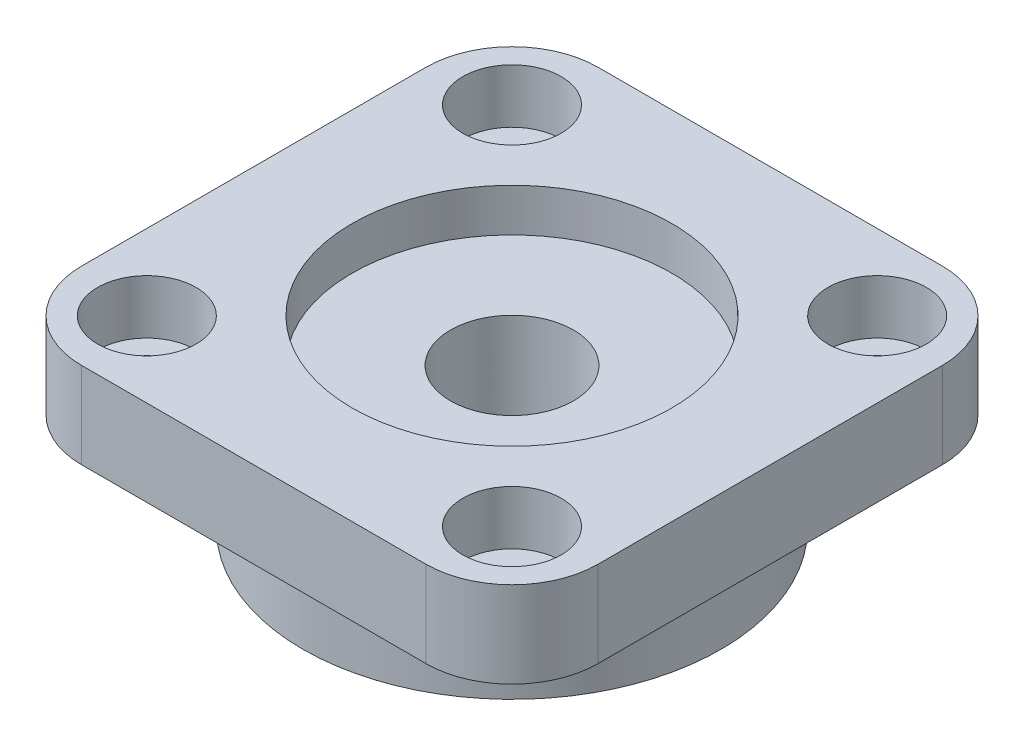
from build123d import *

# Parameters (mm, degrees)
SKETCH1_R                                           = 17
SKETCH1_R_2                                         = 5
BOSS_EXTRUDE1_DEPTH                                 = 8
SKETCH2_W                                           = 42
SKETCH2_H                                           = 42
SKETCH2_R                                           = 5
BOSS_EXTRUDE2_DEPTH                                 = 7
FILLET1_R                                           = 7
CBORE_FOR_M4_HEX_SOCKET_HEAD_CAP_SCREW1_D           = 4.5
CBORE_FOR_M4_HEX_SOCKET_HEAD_CAP_SCREW1_CBORE_D     = 8
CBORE_FOR_M4_HEX_SOCKET_HEAD_CAP_SCREW1_CBORE_DEPTH = 4.4
SKETCH5_R                                           = 13
CUT_EXTRUDE1_DEPTH                                  = 3.5
CUT_EXTRUDE2_START                                  = -3.5
SKETCH6_R                                           = 13
CUT_EXTRUDE2_DEPTH                                  = 3.5


with BuildPart() as part:
    # Sketch1 → Boss-Extrude1 (new body)
    with BuildSketch(Plane(origin=(0, 0, 0), x_dir=(1, 0, 0), z_dir=(0, 1, 0))):
        with Locations(Location((0, 0, 0), (0, 0, 270))):
            Circle(SKETCH1_R)
        with Locations(Location((0, 0, 0), (0, 0, 270))):
            Circle(SKETCH1_R_2, mode=Mode.SUBTRACT)
    extrude(amount=BOSS_EXTRUDE1_DEPTH)

    # Sketch2 → Boss-Extrude2 (add)
    with BuildSketch(Plane(origin=(0, 8, 0), x_dir=(1, 0, 0), z_dir=(0, 1, 0))):
        Rectangle(SKETCH2_W, SKETCH2_H)
        with Locations(Location((0, 0, 0), (0, 0, 270))):
            Circle(SKETCH2_R, mode=Mode.SUBTRACT)
    extrude(amount=BOSS_EXTRUDE2_DEPTH)

    # Fillet1
    fillet1_edges = [part.edges().sort_by_distance(p)[0] for p in [
        (-21, 11.5, -21),
        (-21, 11.5, 21),
        (21, 11.5, 21),
        (21, 11.5, -21),
    ]]
    fillet(fillet1_edges, radius=FILLET1_R)

    # CBORE for M4 Hex Socket Head Cap Screw1 (through all)
    with Locations(Plane(origin=(-14.849242405, 15, -14.849242405), x_dir=(0, 0, 1), z_dir=(0, 1, 0))):
        with Locations((0, 0), (0, 29.69848481), (29.69848481, 29.69848481), (29.69848481, 0)):
            CounterBoreHole(CBORE_FOR_M4_HEX_SOCKET_HEAD_CAP_SCREW1_D / 2, CBORE_FOR_M4_HEX_SOCKET_HEAD_CAP_SCREW1_CBORE_D / 2, CBORE_FOR_M4_HEX_SOCKET_HEAD_CAP_SCREW1_CBORE_DEPTH)

    # Sketch5 → Cut-Extrude1 (cut)
    with BuildSketch(Plane.XZ):
        with Locations(Location((0, 0, 0), (0, 0, 270))):
            Circle(SKETCH5_R)
    extrude(amount=-CUT_EXTRUDE1_DEPTH, mode=Mode.SUBTRACT)

    # Sketch6 → Cut-Extrude2 (cut)
    with BuildSketch(Plane(origin=(0, 15, 0), x_dir=(1, 0, 0), z_dir=(0, 1, 0)).offset(CUT_EXTRUDE2_START)):
        with Locations(Location((0, 0, 0), (0, 0, 90))):
            Circle(SKETCH6_R)
    extrude(amount=CUT_EXTRUDE2_DEPTH, mode=Mode.SUBTRACT)


solid = part.part
